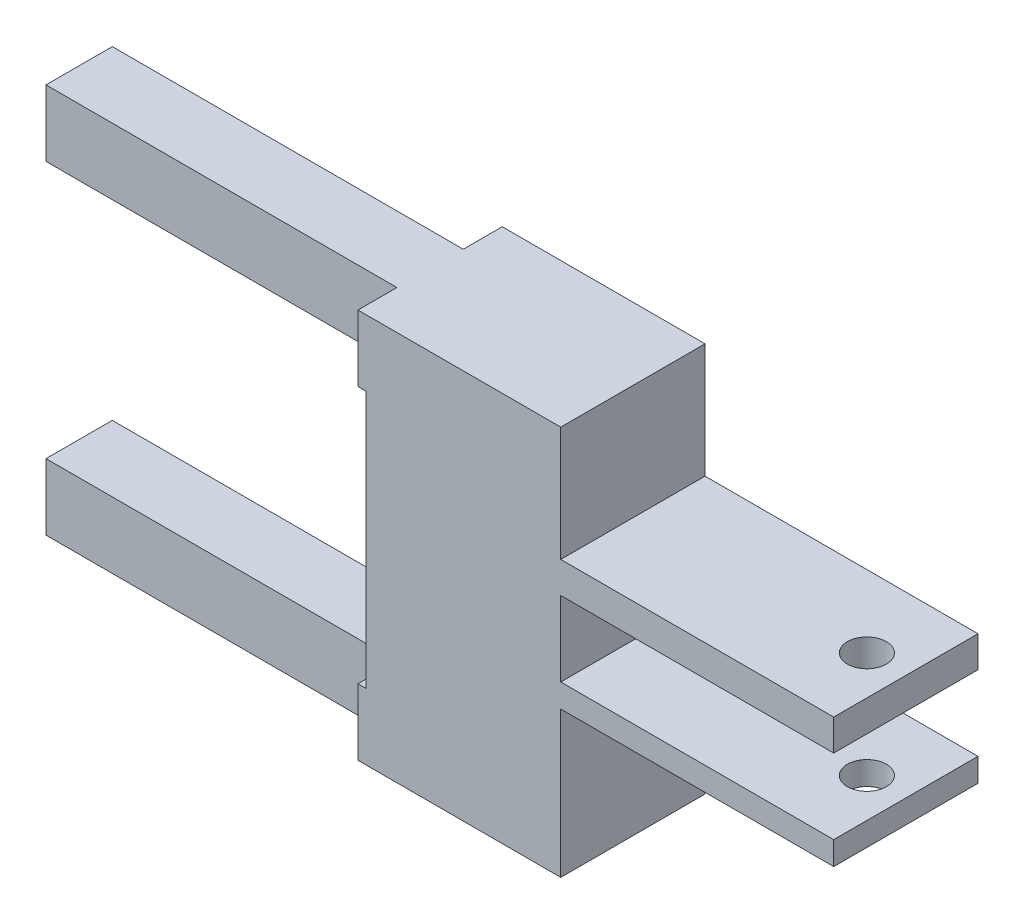
from build123d import *

# Parameters (mm, degrees)
SKETCH_1_W          = 92
SKETCH_1_H          = 17
SKETCH_1_W_2        = 70
SKETCH_1_H_2        = 8
SKETCH_1_H_3        = 6
EXTRUDE_1_DEPTH     = 37
SKETCH_2_R          = 5
CUT_EXTRUDE_1_DEPTH = 142.57603411
SKETCH_3_W          = 10
SKETCH_3_H          = 17
CUT_EXTRUDE_2_DEPTH = 90


with BuildPart() as part:
    # 草图1 → 凸台-拉伸1 (new body)
    with BuildSketch(Plane.XY):
        with Locations((-71, 41.5)):
            Rectangle(SKETCH_1_W, SKETCH_1_H)
        with Locations((-71, -41.5)):
            Rectangle(SKETCH_1_W, SKETCH_1_H)
        with Locations((60, 16.610009448)):
            Rectangle(SKETCH_1_W_2, SKETCH_1_H_2)
        with Locations((60, -9.610009448)):
            Rectangle(SKETCH_1_W_2, SKETCH_1_H_3)
        Polygon((25, 50), (-25, 50), (-25, 33), (-25, -33), (-25, -50), (25, -50), (25, -12.610009448), (25, -6.610009448), (25, 12.610009448), (25, 20.610009448), align=None)
    extrude(amount=EXTRUDE_1_DEPTH)

    # 草图2 → 切除-拉伸1 (cut, through all)
    with BuildSketch(Plane(origin=(0, 20.610009448, 0), x_dir=(1, 0, 0), z_dir=(0, 1, 0))):
        with Locations(Location((85, -18.5, 0), (0, 0, 270))):
            Circle(SKETCH_2_R)
    extrude(amount=-CUT_EXTRUDE_1_DEPTH, mode=Mode.SUBTRACT)

    # 草图3 → 切除-拉伸2 (cut)
    with BuildSketch(Plane.ZY.offset(117)):
        with Locations((5, -41.5)):
            Rectangle(SKETCH_3_W, SKETCH_3_H)
        with Locations((32, -41.5)):
            Rectangle(SKETCH_3_W, SKETCH_3_H)
        with Locations((32, 41.5)):
            Rectangle(SKETCH_3_W, SKETCH_3_H)
        with Locations((5, 41.5)):
            Rectangle(SKETCH_3_W, SKETCH_3_H)
    extrude(amount=-CUT_EXTRUDE_2_DEPTH, mode=Mode.SUBTRACT)


solid = part.part
